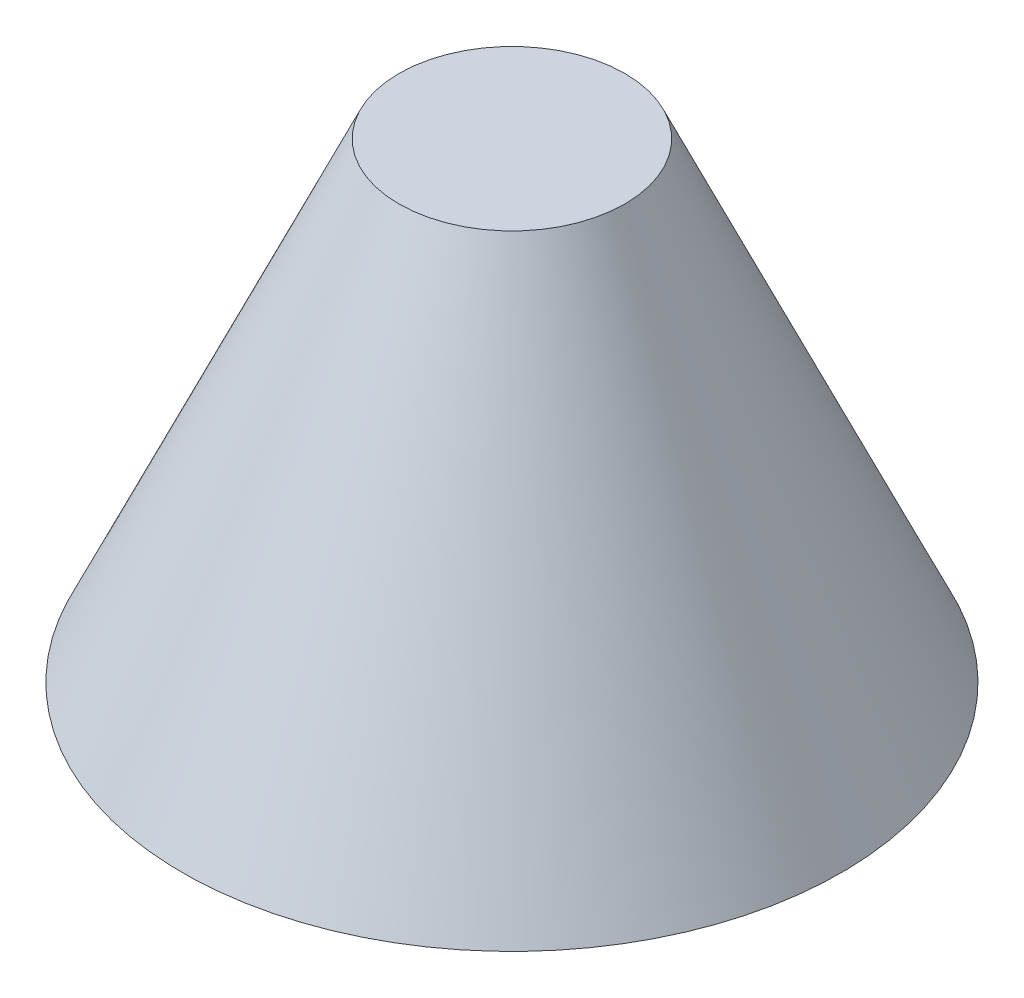
from build123d import *


with BuildPart() as part:
    # 草图3 → Shade (revolve)
    with BuildSketch(Plane.XY, mode=Mode.PRIVATE) as shade_sk:
        Polygon((0, 0), (35, 0), (12, 50), (0, 50), align=None)
    revolve(shade_sk.sketch.rotate(Axis((0, 0, 0), (0, 1, 0)), 90), axis=Axis((0, 0, 0), (0, 1, 0)))


solid = part.part
